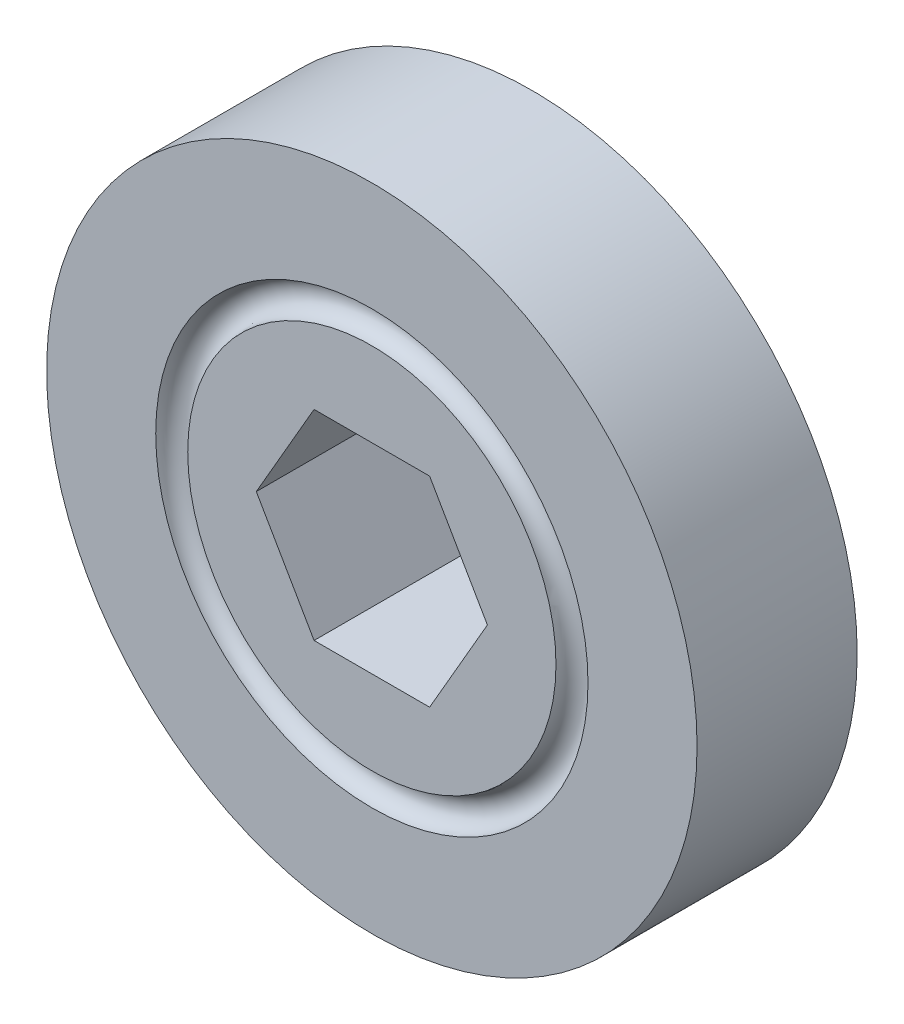
from build123d import *

# Parameters (mm, degrees)
CUT_EXTRUDE1_REACH = 32.904


with BuildPart() as part:
    # Sketch1 → Revolve1 (revolve)
    with BuildSketch(Plane(origin=(0, 0, 0), x_dir=(0, 0, -1), z_dir=(1, 0, 0)), mode=Mode.PRIVATE) as revolve1_sk:
        with BuildLine():
            Line((-5.08, 20.6375), (5.08, 20.6375))
            Line((5.08, 20.6375), (5.08, 13.716))
            ThreePointArc((5.08, 13.716), (4.064, 12.7), (5.08, 11.684))
            Line((5.08, 11.684), (5.08, 0))
            Line((5.08, 0), (-5.08, 0))
            Line((-5.08, 0), (-5.08, 11.684))
            ThreePointArc((-5.08, 11.684), (-4.064, 12.7), (-5.08, 13.716))
            Line((-5.08, 13.716), (-5.08, 20.6375))
        make_face()
    revolve(revolve1_sk.sketch.rotate(Axis((0, 0, 5.08), (0, 0, -1)), 90), axis=Axis((0, 0, 5.08), (0, 0, -1)))

    # Sketch2 → Cut-Extrude1 (cut, up to next)
    with BuildSketch(Plane.XY.offset(5.08), mode=Mode.PRIVATE) as cut_extrude1_sk1:
        Polygon((-3.666174209, 6.35), (-7.332348419, 0), (-3.666174209, -6.35), (3.666174209, -6.35), (7.332348419, 0), (3.666174209, 6.35), align=None)
    cut_extrude1_tool1 = extrude(cut_extrude1_sk1.sketch, amount=-CUT_EXTRUDE1_REACH, mode=Mode.PRIVATE) & part.part
    add(cut_extrude1_tool1.solids().sort_by_distance((0, 0, 5.08))[0], mode=Mode.SUBTRACT)


solid = part.part
